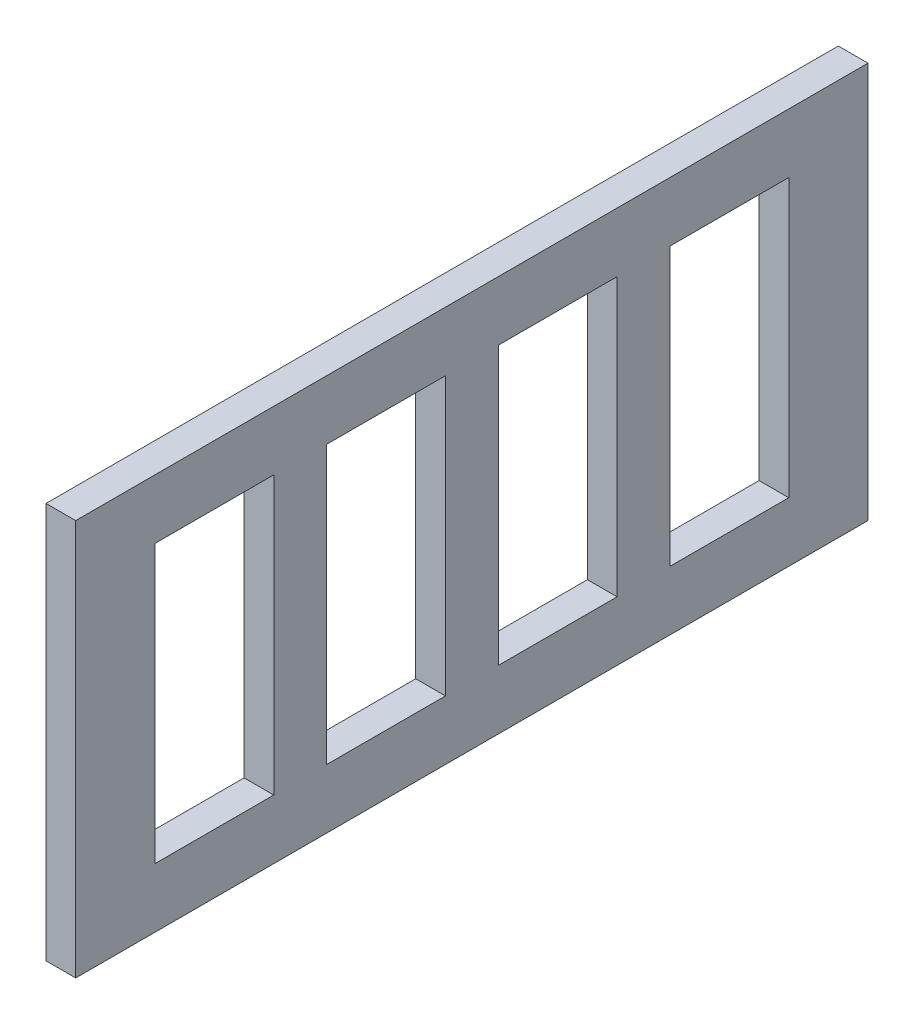
from build123d import *

# Parameters (mm, degrees)
SKETCH1_W           = 400
SKETCH1_H           = 200
SKETCH1_W_2         = 60
SKETCH1_H_2         = 140
BOSS_EXTRUDE1_DEPTH = 15


with BuildPart() as part:
    # Sketch1 → Boss-Extrude1 (new body)
    with BuildSketch(Plane(origin=(0, 0, 0), x_dir=(0, 0, -1), z_dir=(1, 0, 0))):
        with Locations((0, 100)):
            Rectangle(SKETCH1_W, SKETCH1_H)
        with Locations((-130, 100)):
            Rectangle(SKETCH1_W_2, SKETCH1_H_2, mode=Mode.SUBTRACT)
        with Locations((-43.333333333, 100)):
            Rectangle(SKETCH1_W_2, SKETCH1_H_2, mode=Mode.SUBTRACT)
        with Locations((43.333333333, 100)):
            Rectangle(SKETCH1_W_2, SKETCH1_H_2, mode=Mode.SUBTRACT)
        with Locations((130, 100)):
            Rectangle(SKETCH1_W_2, SKETCH1_H_2, mode=Mode.SUBTRACT)
    extrude(amount=BOSS_EXTRUDE1_DEPTH)


solid = part.part
